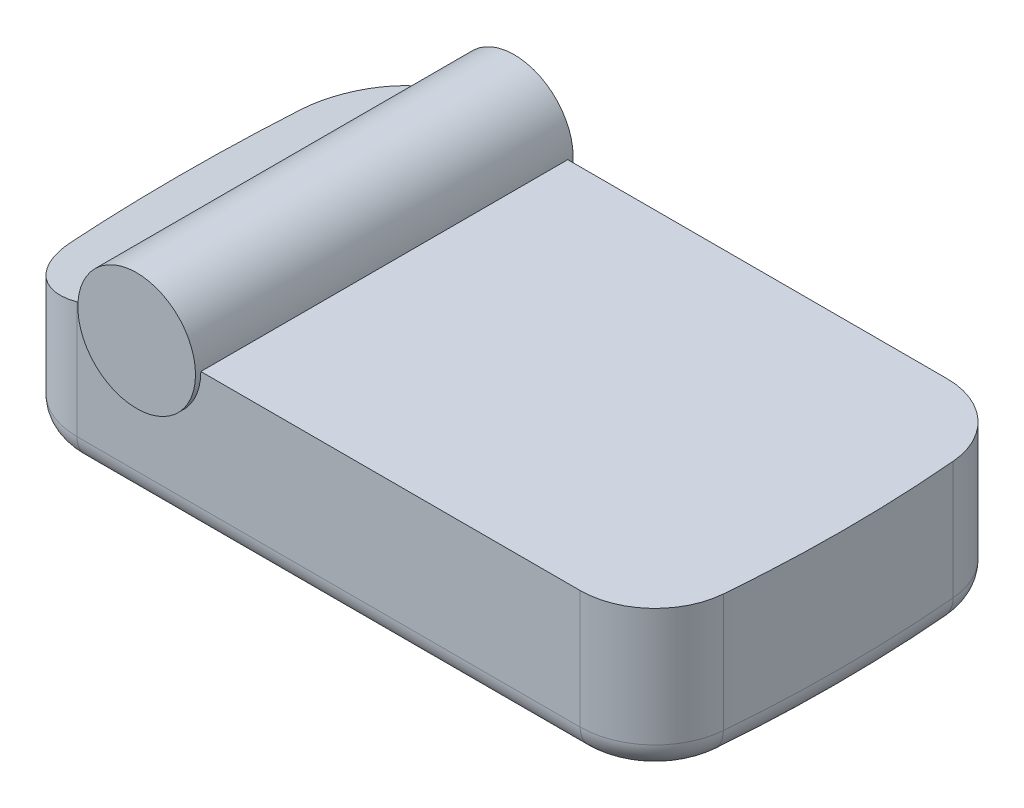
from build123d import *

# Parameters (mm, degrees)
BOSS_EXTRUDE1_DEPTH      = 13.6
FILLET1_R                = 2.54
BOSS_EXTRUDE2_DEPTH      = 0.5
BOSS_EXTRUDE2_DEPTH_BACK = 34.8
SKETCH3_R                = 5.5
CUT_EXTRUDE2_DEPTH       = 51.336393456


with BuildPart() as part:
    # Sketch1 → Boss-Extrude1 (new body)
    with BuildSketch(Plane(origin=(0, 0, 0), x_dir=(1, 0, 0), z_dir=(0, 1, 0))):
        with BuildLine():
            Line((-23.519969056, 17.15), (23.519969056, 17.15))
            ThreePointArc((23.519969056, 17.15), (28.255759205, 15.304831876), (30.494883917, 10.742083333))
            ThreePointArc((30.494883917, 10.742083333), (30.95, 0), (30.494883917, -10.742083333))
            ThreePointArc((30.494883917, -10.742083333), (28.255759205, -15.304831876), (23.519969056, -17.15))
            Line((23.519969056, -17.15), (-23.519969056, -17.15))
            ThreePointArc((-23.519969056, -17.15), (-28.255759205, -15.304831876), (-30.494883917, -10.742083333))
            ThreePointArc((-30.494883917, -10.742083333), (-30.95, 0), (-30.494883917, 10.742083333))
            ThreePointArc((-30.494883917, 10.742083333), (-28.255759205, 15.304831876), (-23.519969056, 17.15))
        make_face()
    extrude(amount=BOSS_EXTRUDE1_DEPTH)

    # Fillet1
    fillet1_edges = [part.edges().sort_by_distance(p)[0] for p in [
        (-30.95, 0, 0),
        (-28.255759205, 0, -15.304831876),
        (0, 0, -17.15),
        (28.255759205, 0, -15.304831876),
        (30.95, 0, 0),
        (28.255759205, 0, 15.304831876),
        (0, 0, 17.15),
        (-28.255759205, 0, 15.304831876),
    ]]
    fillet(fillet1_edges, radius=FILLET1_R)

    # Sketch3 → Boss-Extrude2 (add, two sides: drawn at the far end of the back side and taken through both)
    with BuildSketch(Plane.XY.offset(17.15).offset(-BOSS_EXTRUDE2_DEPTH_BACK)):
        with Locations((-17.438993952, 13.6)):
            Circle(SKETCH3_R)
    extrude(amount=BOSS_EXTRUDE2_DEPTH + BOSS_EXTRUDE2_DEPTH_BACK)

    # Sketch5 → Cut-Extrude2 (cut, through all)
    with BuildSketch(Plane.XY.offset(17.15)):
        Polygon((-22.938993952, 13.6), (-30.95, 11.453457399), (-30.95, 13.6), align=None)
    extrude(amount=-CUT_EXTRUDE2_DEPTH, mode=Mode.SUBTRACT)


solid = part.part
